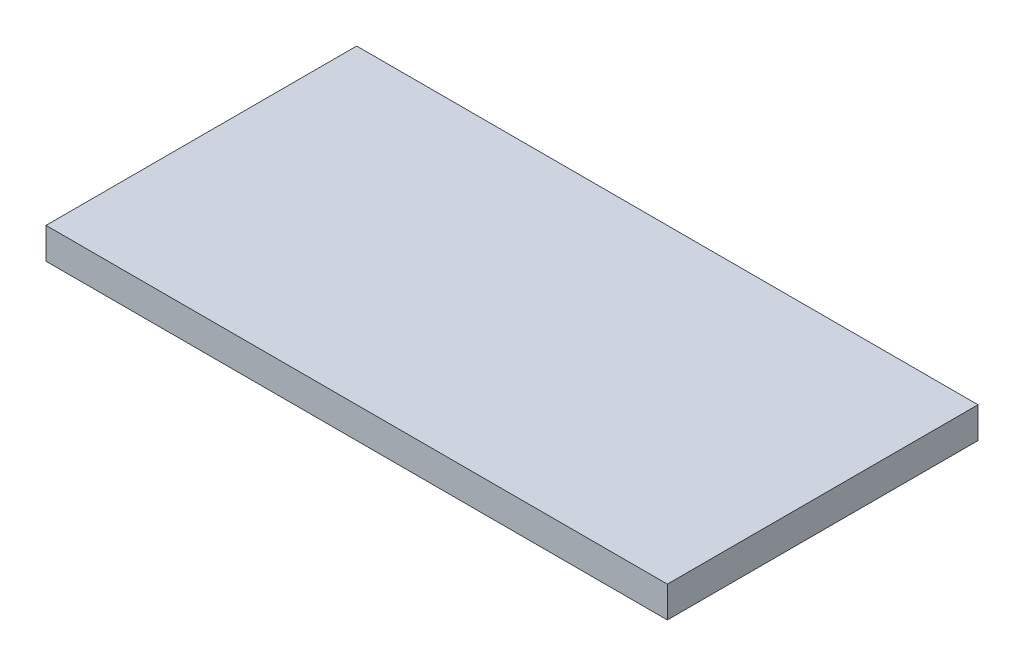
from build123d import *

# Parameters (mm, degrees)
SKETCH_1_W      = 200
SKETCH_1_H      = 100
EXTRUDE_1_DEPTH = 10


with BuildPart() as part:
    # 草图1 → 凸台-拉伸1 (new body)
    with BuildSketch(Plane(origin=(0, 0, 0), x_dir=(1, 0, 0), z_dir=(0, 1, 0))):
        with Locations((98.159509202, -50)):
            Rectangle(SKETCH_1_W, SKETCH_1_H)
    extrude(amount=EXTRUDE_1_DEPTH)


solid = part.part
